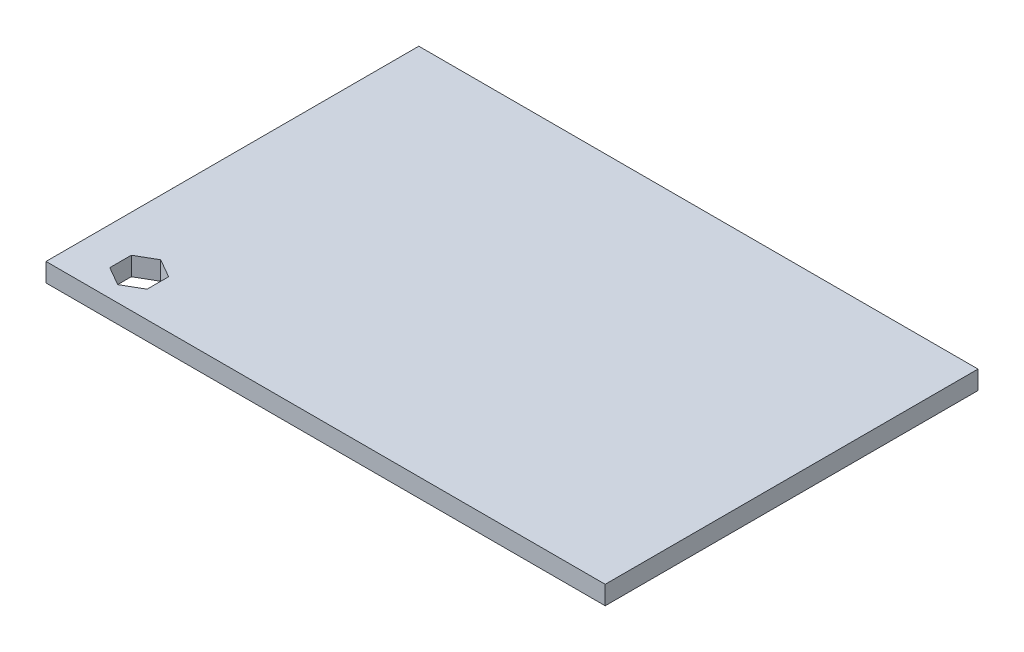
from build123d import *

# Parameters (mm, degrees)
SKETCH1_W           = 381
SKETCH1_H           = 254
BOSS_EXTRUDE1_DEPTH = 12.7
CUT_EXTRUDE1_DEPTH  = 459.081095441


with BuildPart() as part:
    # Sketch1 → Boss-Extrude1 (new body)
    with BuildSketch(Plane(origin=(0, 0, 0), x_dir=(1, 0, 0), z_dir=(0, 1, 0))):
        with Locations((190.5, 127)):
            Rectangle(SKETCH1_W, SKETCH1_H)
    extrude(amount=BOSS_EXTRUDE1_DEPTH)

    # Sketch2 → Cut-Extrude1 (cut, through all)
    with BuildSketch(Plane(origin=(0, 12.7, 0), x_dir=(1, 0, 0), z_dir=(0, 1, 0))):
        Polygon((38.1, 10.735303163), (50.8, 18.067651581), (50.8, 32.732348419), (38.1, 40.064696837), (25.4, 32.732348419), (25.4, 18.067651581), align=None)
    extrude(amount=-CUT_EXTRUDE1_DEPTH, mode=Mode.SUBTRACT)


solid = part.part
